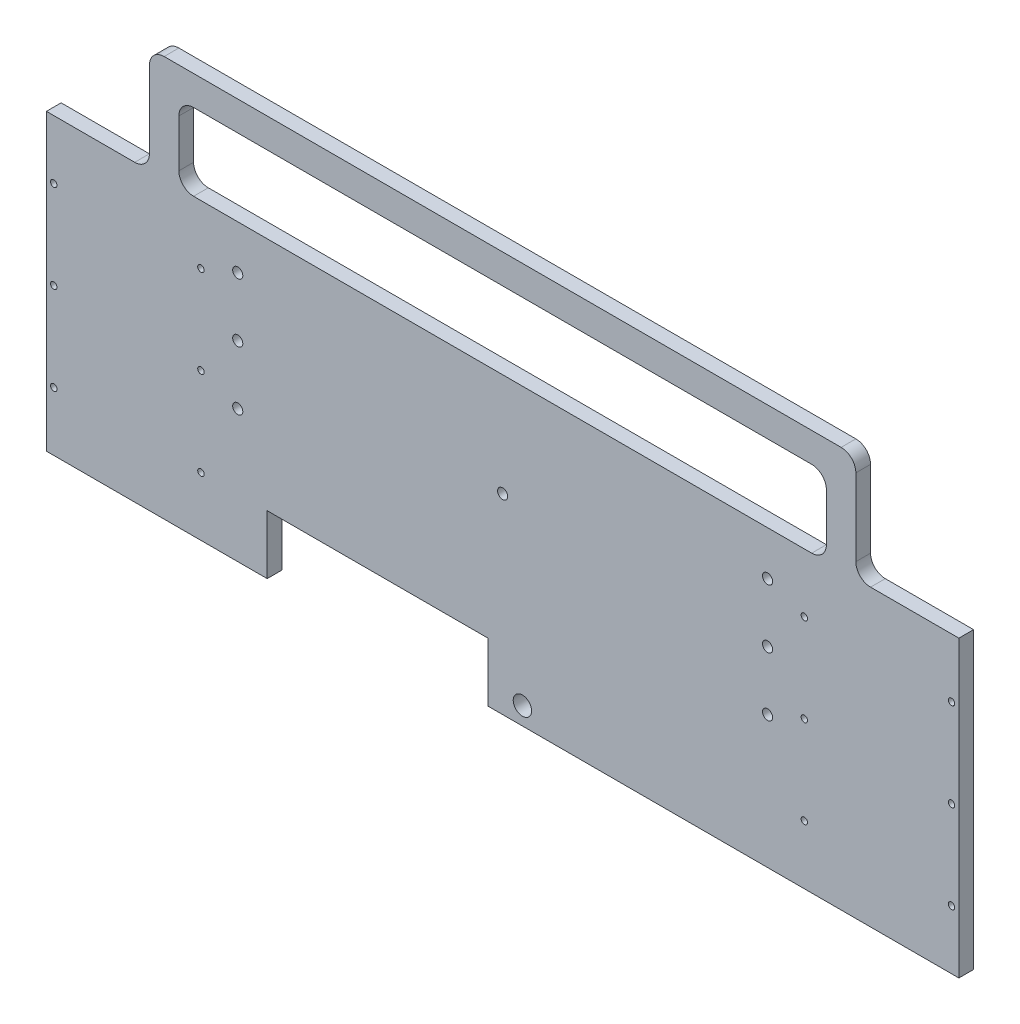
from build123d import *

# Parameters (mm, degrees)
SKETCH1_W                            = 393.7
SKETCH1_H                            = 127
BOSS_EXTRUDE1_DEPTH                  = 6.35
BOSS_EXTRUDE2_DEPTH                  = 6.35
FILLET1_R                            = 6.35
SKETCH11_W                           = 95.25
SKETCH11_H                           = 25.4
CUT_EXTRUDE1_DEPTH                   = 226.28847424
F_5_16_0_3125_DIAMETER_HOLE1_D       = 7.9375
F_11_64_0_17188_DIAMETER_HOLE1_D     = 4.365752
F_35_0_11_DIAMETER_HOLE1_D           = 2.794
F_35_0_11_DIAMETER_HOLE1_DEPTH       = 8.89
F_35_0_11_DIAMETER_HOLE1_TIP         = 0.839402285
F_11_64_0_17188_DIAMETER_HOLE2_D     = 4.365752
F_11_64_0_17188_DIAMETER_HOLE2_DEPTH = 8.89
F_11_64_0_17188_DIAMETER_HOLE2_TIP   = 1.311604225


with BuildPart() as part:
    # Sketch1 → Boss-Extrude1 (new body)
    with BuildSketch(Plane.XY):
        Rectangle(SKETCH1_W, SKETCH1_H)
    extrude(amount=BOSS_EXTRUDE1_DEPTH)

    # Sketch10 → Boss-Extrude2 (add)
    with BuildSketch(Plane.XY.offset(6.35)):
        Polygon((-152.4, 96.68304999), (-152.4, 63.5), (-139.7, 63.5), (-139.7, 96.68304999), (0, 96.68304999), (0, 109.38304999), (-146.05, 109.38304999), (-152.4, 109.38304999), align=None)
        Polygon((139.7, 96.68304999), (139.7, 63.5), (152.4, 63.5), (152.4, 109.38304999), (0, 109.38304999), (0, 96.68304999), align=None)
    extrude(amount=-BOSS_EXTRUDE2_DEPTH)

    # Fillet1
    fillet1_edges = [part.edges().sort_by_distance(p)[0] for p in [
        (139.7, 96.68304999, 3.175),
        (-139.7, 96.68304999, 3.175),
        (-139.7, 63.5, 3.175),
        (-152.4, 63.5, 3.175),
        (-152.4, 109.38304999, 3.175),
        (152.4, 109.38304999, 3.175),
        (152.4, 63.5, 3.175),
        (139.7, 63.5, 3.175),
    ]]
    fillet(fillet1_edges, radius=FILLET1_R)

    # Sketch11 → Cut-Extrude1 (cut, through all)
    with BuildSketch(Plane.XY.offset(6.35)):
        with Locations((-53.975, -50.8)):
            Rectangle(SKETCH11_W, SKETCH11_H)
    extrude(amount=-CUT_EXTRUDE1_DEPTH, mode=Mode.SUBTRACT)

    # 5/16 (0.3125) Diameter Hole1 (through all)
    with Locations(Plane.XY.offset(6.35)):
        with Locations((8.534908, -55.88)):
            Hole(F_5_16_0_3125_DIAMETER_HOLE1_D / 2)

    # 11/64 (0.17188) Diameter Hole1 (through all)
    with Locations(Plane.XY.offset(6.35)):
        with Locations((-114.3, 44.45), (-114.3, 19.05), (-114.3, -6.35), (114.3, 44.45), (114.3, 19.05), (114.3, -6.35)):
            Hole(F_11_64_0_17188_DIAMETER_HOLE1_D / 2)

    # #35 (0.11) Diameter Hole1
    with Locations(Plane.XY.offset(6.35)):
        with Locations((-193.675, 38.1), (-130.175, 38.1), (-130.175, 0), (-193.675, 0), (-193.675, -38.1), (-130.175, -38.1), (130.175, -38.1), (193.675, -38.1), (193.675, 0), (193.675, 38.1), (130.175, 38.1), (130.175, 0)):
            Hole(F_35_0_11_DIAMETER_HOLE1_D / 2, depth=F_35_0_11_DIAMETER_HOLE1_DEPTH)
            with Locations((0, 0, -(F_35_0_11_DIAMETER_HOLE1_DEPTH + F_35_0_11_DIAMETER_HOLE1_TIP / 2))):  # 118° drill point
                Cone(0, F_35_0_11_DIAMETER_HOLE1_D / 2, F_35_0_11_DIAMETER_HOLE1_TIP, mode=Mode.SUBTRACT)

    # 11/64 (0.17188) Diameter Hole2
    with Locations(Plane.XY.offset(6.35)):
        with Locations((0, 19.05)):
            Hole(F_11_64_0_17188_DIAMETER_HOLE2_D / 2, depth=F_11_64_0_17188_DIAMETER_HOLE2_DEPTH)
            with Locations((0, 0, -(F_11_64_0_17188_DIAMETER_HOLE2_DEPTH + F_11_64_0_17188_DIAMETER_HOLE2_TIP / 2))):  # 118° drill point
                Cone(0, F_11_64_0_17188_DIAMETER_HOLE2_D / 2, F_11_64_0_17188_DIAMETER_HOLE2_TIP, mode=Mode.SUBTRACT)


solid = part.part
